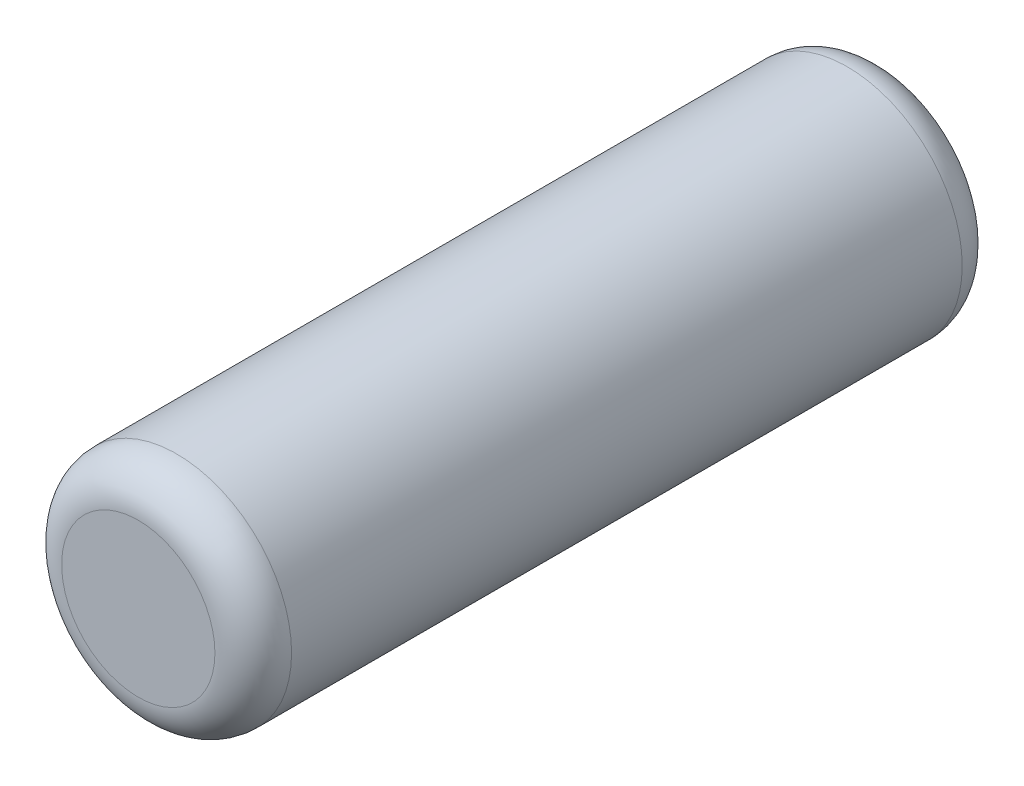
from build123d import *

# Parameters (mm, degrees)
SKETCH_1_R      = 3
EXTRUDE_1_DEPTH = 19.5
FILLET_1_R      = 1


with BuildPart() as part:
    # ｽｹｯﾁ1 → ﾎﾞｽ - 押し出し1 (new body)
    with BuildSketch(Plane.XY):
        Circle(SKETCH_1_R)
    extrude(amount=EXTRUDE_1_DEPTH)

    # ﾌｨﾚｯﾄ1
    fillet_1_edges = [part.edges().sort_by_distance(p)[0] for p in [
        (-3, 0, 0),
        (-3, 0, 19.5),
    ]]
    fillet(fillet_1_edges, radius=FILLET_1_R)


solid = part.part
